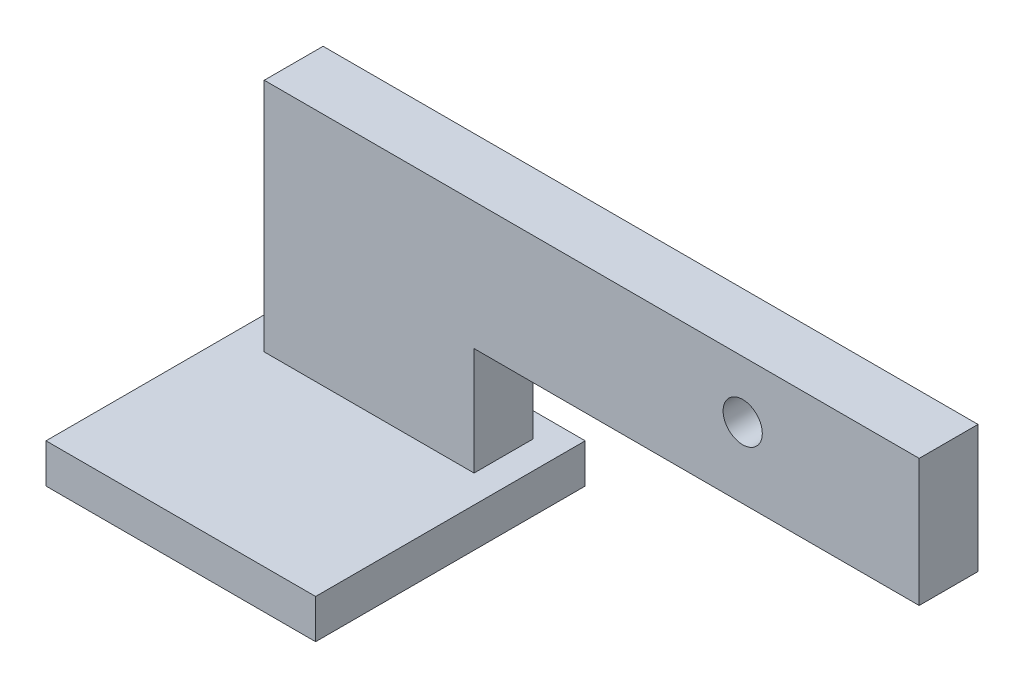
from build123d import *

# Parameters (mm, degrees)
BOSS_EXTRUDE1_DEPTH = 19.05
SKETCH2_R           = 12.7
CUT_EXTRUDE1_DEPTH  = 453.333994301
SKETCH4_W           = 174.625
SKETCH4_H           = 174.625
BOSS_EXTRUDE2_DEPTH = 25.4


with BuildPart() as part:
    # Sketch1 → Boss-Extrude1 (new, symmetric)
    with BuildSketch(Plane.XY):
        Polygon((0, 0), (0, 152.4), (424.18, 152.4), (424.18, 69.85), (135.89, 69.85), (135.89, 0), align=None)
    extrude(amount=BOSS_EXTRUDE1_DEPTH, both=True)

    # Sketch2 → Cut-Extrude1 (cut, through all)
    with BuildSketch(Plane.XY.offset(19.05)):
        with Locations((309.88, 115.57)):
            Circle(SKETCH2_R)
    extrude(amount=-CUT_EXTRUDE1_DEPTH, mode=Mode.SUBTRACT)


with BuildPart() as body_2:
    # Sketch4 → Boss-Extrude2 (new body)
    with BuildSketch(Plane.XZ):
        with Locations((66.4845, 52.2605)):
            Rectangle(SKETCH4_W, SKETCH4_H)
    extrude(amount=BOSS_EXTRUDE2_DEPTH)


solid = Compound([part.part, body_2.part])
